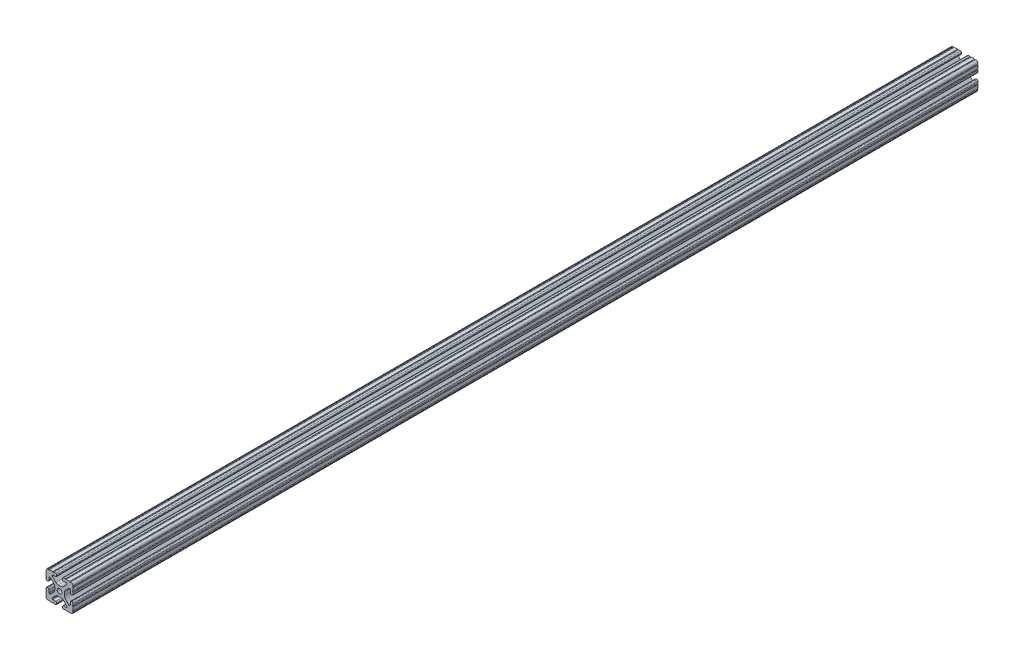
from build123d import *

# Parameters (mm, degrees)
SKETCH1_R      = 3.3274
EXTRUDE1_DEPTH = 1270


with BuildPart() as part:
    # Sketch1 → Extrude1 (new body)
    with BuildSketch(Plane.XY):
        with BuildLine():
            Line((-10.022898969, 12.91475973), (-5.252158105, 8.144007132))
            ThreePointArc((-5.252158105, 8.144007132), (-3.715177372, 7.117027388), (-1.902183975, 6.7564))
            Line((-1.902183975, 6.7564), (1.902183975, 6.7564))
            ThreePointArc((1.902183975, 6.7564), (3.715177372, 7.117027388), (5.252158105, 8.144007132))
            Line((5.252158105, 8.144007132), (10.022898969, 12.91475973))
            ThreePointArc((10.022898969, 12.91475973), (10.218362387, 13.207291992), (10.287, 13.552357131))
            Line((10.287, 13.552357131), (10.287, 14.0843))
            ThreePointArc((10.287, 14.0843), (10.022898185, 14.721898185), (9.3853, 14.986))
            Line((9.3853, 14.986), (5.617617549, 14.986))
            ThreePointArc((5.617617549, 14.986), (4.519044045, 15.441044045), (4.064, 16.539617549))
            Line((4.064, 16.539617549), (4.064, 17.496382451))
            ThreePointArc((4.064, 17.496382451), (4.519044045, 18.594955955), (5.617617549, 19.05))
            Line((5.617617549, 19.05), (7.974178704, 19.05))
            ThreePointArc((7.974178704, 19.05), (8.736178704, 18.288), (9.498178704, 19.05))
            Line((9.498178704, 19.05), (14.327719207, 19.05))
            ThreePointArc((14.327719207, 19.05), (15.087603123, 18.231251131), (15.847487039, 19.05))
            ThreePointArc((15.847487039, 19.05), (18.120176289, 18.120192083), (19.05, 15.847509295))
            ThreePointArc((19.05, 15.847509295), (18.231250992, 15.08762539), (19.05, 14.327741484))
            Line((19.05, 14.327741484), (19.05, 9.496091471))
            ThreePointArc((19.05, 9.496091471), (18.231250992, 8.736207565), (19.05, 7.97632366))
            Line((19.05, 7.97632366), (19.05, 5.617617549))
            ThreePointArc((19.05, 5.617617549), (18.594955955, 4.519044045), (17.496382451, 4.064))
            Line((17.496382451, 4.064), (16.539617549, 4.064))
            ThreePointArc((16.539617549, 4.064), (15.441044045, 4.519044045), (14.986, 5.617617549))
            Line((14.986, 5.617617549), (14.986, 9.385342516))
            ThreePointArc((14.986, 9.385342516), (14.721898185, 10.022940701), (14.0843, 10.287042516))
            Line((14.0843, 10.287042516), (13.516042086, 10.287042516))
            ThreePointArc((13.516042086, 10.287042516), (13.170975923, 10.218404478), (12.878443117, 10.022939917))
            Line((12.878443117, 10.022939917), (8.14758008, 5.292065243))
            ThreePointArc((8.14758008, 5.292065243), (7.117955879, 3.751120653), (6.7564, 1.933453584))
            Line((6.7564, 1.933453584), (6.7564, -1.933453584))
            ThreePointArc((6.7564, -1.933453584), (7.117955879, -3.751120653), (8.14758008, -5.292065243))
            Line((8.14758008, -5.292065243), (12.878443117, -10.022939917))
            ThreePointArc((12.878443117, -10.022939917), (13.170975923, -10.218404478), (13.516042086, -10.287042516))
            Line((13.516042086, -10.287042516), (14.0843, -10.287042516))
            ThreePointArc((14.0843, -10.287042516), (14.721898185, -10.022940701), (14.986, -9.385342516))
            Line((14.986, -9.385342516), (14.986, -5.617617549))
            ThreePointArc((14.986, -5.617617549), (15.441044045, -4.519044045), (16.539617549, -4.064))
            Line((16.539617549, -4.064), (17.496382451, -4.064))
            ThreePointArc((17.496382451, -4.064), (18.594955955, -4.519044045), (19.05, -5.617617549))
            Line((19.05, -5.617617549), (19.05, -7.976318491))
            ThreePointArc((19.05, -7.976318491), (18.231250992, -8.736202396), (19.05, -9.496086302))
            Line((19.05, -9.496086302), (19.05, -14.32774291))
            ThreePointArc((19.05, -14.32774291), (18.231250992, -15.087626816), (19.05, -15.847510721))
            ThreePointArc((19.05, -15.847510721), (18.120175716, -18.120192644), (15.847486868, -19.05))
            ThreePointArc((15.847486868, -19.05), (15.087602952, -18.231251131), (14.327719036, -19.05))
            Line((14.327719036, -19.05), (9.496062448, -19.05))
            ThreePointArc((9.496062448, -19.05), (8.736178532, -18.231251131), (7.976294616, -19.05))
            Line((7.976294616, -19.05), (5.617617549, -19.05))
            ThreePointArc((5.617617549, -19.05), (4.519044045, -18.594955955), (4.064, -17.496382451))
            Line((4.064, -17.496382451), (4.064, -16.539617549))
            ThreePointArc((4.064, -16.539617549), (4.519044045, -15.441044045), (5.617617549, -14.986))
            Line((5.617617549, -14.986), (9.3853, -14.986))
            ThreePointArc((9.3853, -14.986), (10.022898185, -14.721898185), (10.287, -14.0843))
            Line((10.287, -14.0843), (10.287, -13.552357131))
            ThreePointArc((10.287, -13.552357131), (10.218362387, -13.207291992), (10.022898969, -12.91475973))
            Line((10.022898969, -12.91475973), (5.252158105, -8.144007132))
            ThreePointArc((5.252158105, -8.144007132), (3.715177372, -7.117027388), (1.902183975, -6.7564))
            Line((1.902183975, -6.7564), (-1.902183975, -6.7564))
            ThreePointArc((-1.902183975, -6.7564), (-3.715177372, -7.117027388), (-5.252158105, -8.144007132))
            Line((-5.252158105, -8.144007132), (-10.022898969, -12.91475973))
            ThreePointArc((-10.022898969, -12.91475973), (-10.218362387, -13.207291992), (-10.287, -13.552357131))
            Line((-10.287, -13.552357131), (-10.287, -14.0843))
            ThreePointArc((-10.287, -14.0843), (-10.022898185, -14.721898185), (-9.3853, -14.986))
            Line((-9.3853, -14.986), (-5.617617549, -14.986))
            ThreePointArc((-5.617617549, -14.986), (-4.519044045, -15.441044045), (-4.064, -16.539617549))
            Line((-4.064, -16.539617549), (-4.064, -17.496382451))
            ThreePointArc((-4.064, -17.496382451), (-4.519044045, -18.594955955), (-5.617617549, -19.05))
            Line((-5.617617549, -19.05), (-7.976294616, -19.05))
            ThreePointArc((-7.976294616, -19.05), (-8.736178532, -18.231251131), (-9.496062448, -19.05))
            Line((-9.496062448, -19.05), (-14.327719036, -19.05))
            ThreePointArc((-14.327719036, -19.05), (-15.087602952, -18.231251131), (-15.847486868, -19.05))
            ThreePointArc((-15.847486868, -19.05), (-18.120175716, -18.120192644), (-19.05, -15.847510721))
            ThreePointArc((-19.05, -15.847510721), (-18.231250992, -15.087626816), (-19.05, -14.32774291))
            Line((-19.05, -14.32774291), (-19.05, -9.496086302))
            ThreePointArc((-19.05, -9.496086302), (-18.231250992, -8.736202396), (-19.05, -7.976318491))
            Line((-19.05, -7.976318491), (-19.05, -5.617617549))
            ThreePointArc((-19.05, -5.617617549), (-18.594955955, -4.519044045), (-17.496382451, -4.064))
            Line((-17.496382451, -4.064), (-16.539617549, -4.064))
            ThreePointArc((-16.539617549, -4.064), (-15.441044045, -4.519044045), (-14.986, -5.617617549))
            Line((-14.986, -5.617617549), (-14.986, -9.385342516))
            ThreePointArc((-14.986, -9.385342516), (-14.721898185, -10.022940701), (-14.0843, -10.287042516))
            Line((-14.0843, -10.287042516), (-13.516042086, -10.287042516))
            ThreePointArc((-13.516042086, -10.287042516), (-13.170975923, -10.218404478), (-12.878443117, -10.022939917))
            Line((-12.878443117, -10.022939917), (-8.14758008, -5.292065243))
            ThreePointArc((-8.14758008, -5.292065243), (-7.117955879, -3.751120653), (-6.7564, -1.933453584))
            Line((-6.7564, -1.933453584), (-6.7564, 1.933453584))
            ThreePointArc((-6.7564, 1.933453584), (-7.117955879, 3.751120653), (-8.14758008, 5.292065243))
            Line((-8.14758008, 5.292065243), (-12.878443117, 10.022939917))
            ThreePointArc((-12.878443117, 10.022939917), (-13.170975923, 10.218404478), (-13.516042086, 10.287042516))
            Line((-13.516042086, 10.287042516), (-14.0843, 10.287042516))
            ThreePointArc((-14.0843, 10.287042516), (-14.721898185, 10.022940701), (-14.986, 9.385342516))
            Line((-14.986, 9.385342516), (-14.986, 5.617617549))
            ThreePointArc((-14.986, 5.617617549), (-15.441044045, 4.519044045), (-16.539617549, 4.064))
            Line((-16.539617549, 4.064), (-17.496382451, 4.064))
            ThreePointArc((-17.496382451, 4.064), (-18.594955955, 4.519044045), (-19.05, 5.617617549))
            Line((-19.05, 5.617617549), (-19.05, 7.97632366))
            ThreePointArc((-19.05, 7.97632366), (-18.231250992, 8.736207565), (-19.05, 9.496091471))
            Line((-19.05, 9.496091471), (-19.05, 14.327741484))
            ThreePointArc((-19.05, 14.327741484), (-18.231250992, 15.08762539), (-19.05, 15.847509295))
            ThreePointArc((-19.05, 15.847509295), (-18.120176289, 18.120192083), (-15.847487039, 19.05))
            ThreePointArc((-15.847487039, 19.05), (-15.087603123, 18.231251131), (-14.327719207, 19.05))
            Line((-14.327719207, 19.05), (-9.498178704, 19.05))
            ThreePointArc((-9.498178704, 19.05), (-8.736178704, 18.288), (-7.974178704, 19.05))
            Line((-7.974178704, 19.05), (-5.617617549, 19.05))
            ThreePointArc((-5.617617549, 19.05), (-4.519044045, 18.594955955), (-4.064, 17.496382451))
            Line((-4.064, 17.496382451), (-4.064, 16.539617549))
            ThreePointArc((-4.064, 16.539617549), (-4.519044045, 15.441044045), (-5.617617549, 14.986))
            Line((-5.617617549, 14.986), (-9.3853, 14.986))
            ThreePointArc((-9.3853, 14.986), (-10.022898185, 14.721898185), (-10.287, 14.0843))
            Line((-10.287, 14.0843), (-10.287, 13.552357131))
            ThreePointArc((-10.287, 13.552357131), (-10.218362387, 13.207291992), (-10.022898969, 12.91475973))
        make_face()
        Circle(SKETCH1_R, mode=Mode.SUBTRACT)
    extrude(amount=-EXTRUDE1_DEPTH)


solid = part.part
